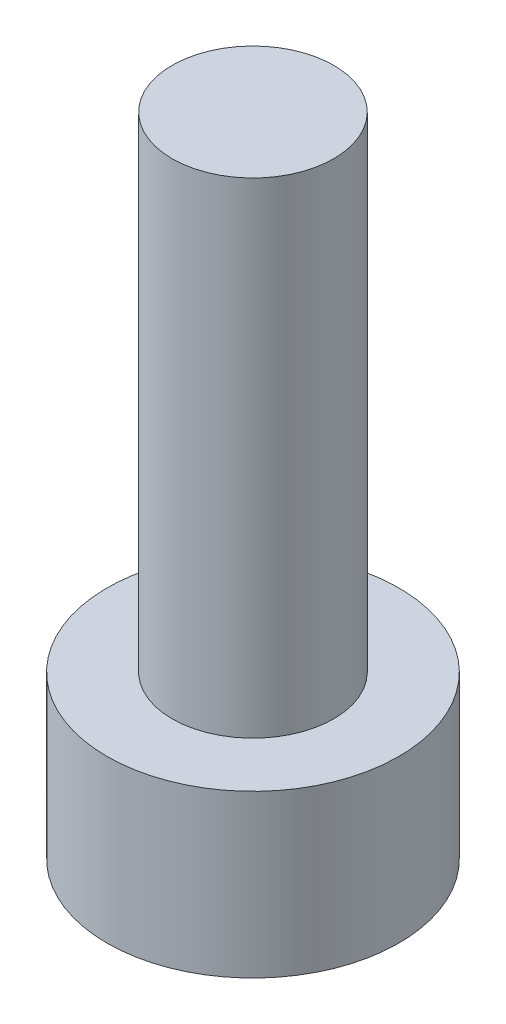
from build123d import *

# Parameters (mm, degrees)
SKETCH_1_R          = 3.61
EXTRUDE_1_DEPTH     = 4
CUT_EXTRUDE_1_DEPTH = 2
SKETCH_3_R          = 2
EXTRUDE_2_DEPTH     = 12


with BuildPart() as part:
    # 草图1 → 凸台-拉伸1 (new body)
    with BuildSketch(Plane(origin=(0, 0, 0), x_dir=(1, 0, 0), z_dir=(0, 1, 0))):
        Circle(SKETCH_1_R)
    extrude(amount=EXTRUDE_1_DEPTH)

    # 草图2 → 切除-拉伸1 (cut)
    with BuildSketch(Plane.XZ):
        Polygon((1.732050808, 0), (0.866025404, 1.5), (-0.866025404, 1.5), (-1.732050808, 0), (-0.866025404, -1.5), (0.866025404, -1.5), align=None)
    extrude(amount=-CUT_EXTRUDE_1_DEPTH, mode=Mode.SUBTRACT)

    # 草图3 → 凸台-拉伸2 (add)
    with BuildSketch(Plane(origin=(0, 4, 0), x_dir=(1, 0, 0), z_dir=(0, 1, 0))):
        Circle(SKETCH_3_R)
    extrude(amount=EXTRUDE_2_DEPTH)


solid = part.part
